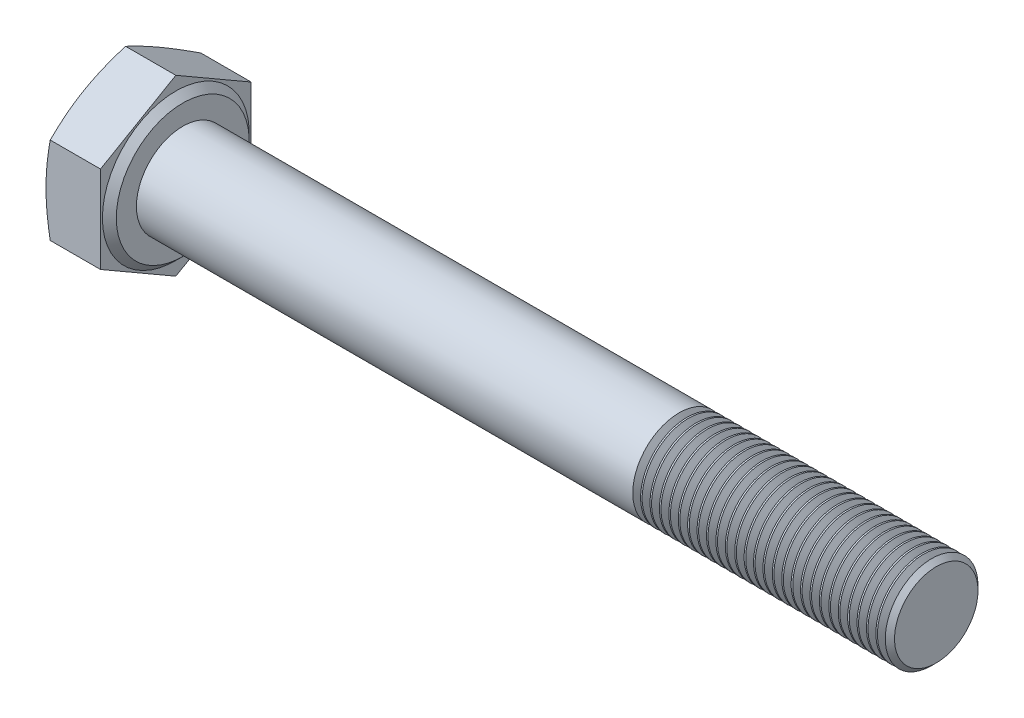
from build123d import *

# Parameters (mm, degrees)
BASEHEAD_DEPTH   = 5.3
SKETCH5_R        = 4
BASEBODY_DEPTH   = 65
CHAMFER1_SIZE    = 0.4
LPATTERN10_COUNT = 27
LPATTERN10_PITCH = 0.8118


with BuildPart() as part:
    # Sketch2 → BaseHead (new body)
    with BuildSketch(Plane(origin=(0, 0, 0), x_dir=(0, 0, -1), z_dir=(1, 0, 0))):
        Polygon((0, -7.505553499), (6.5, -3.75277675), (6.5, 3.75277675), (0, 7.505553499), (-6.5, 3.75277675), (-6.5, -3.75277675), align=None)
    extrude(amount=BASEHEAD_DEPTH)

    # Sketch3 → BearingFace (revolve, cut)
    with BuildSketch(Plane.XY, mode=Mode.PRIVATE) as bearingface_sk:
        Polygon((5.3, 7.505553499), (5.3, 5.735), (4.7, 6.335), (4.7, 7.505553499), align=None)
    revolve(bearingface_sk.sketch.rotate(Axis((-0.957090588, 0, 0), (1, 0, 0)), 90), axis=Axis((-0.957090588, 0, 0), (1, 0, 0)), mode=Mode.SUBTRACT)

    # Sketch4 → HeadChamfer (revolve, cut)
    with BuildSketch(Plane.XY):
        Polygon((0, 7.505553499), (0.365991543, 7.505553499), (0, 6.5), align=None)
    revolve(axis=Axis((-0.493528746, 0, 0), (1, 0, 0)), mode=Mode.SUBTRACT)

    # Sketch5 → BaseBody (add)
    with BuildSketch(Plane(origin=(5.3, 0, 0), x_dir=(0, 0, -1), z_dir=(1, 0, 0))):
        with Locations(Location((0, 0, 0), (0, 0, 180))):
            Circle(SKETCH5_R)
    extrude(amount=BASEBODY_DEPTH)

    # Chamfer1
    chamfer1_edges = [part.edges().sort_by_distance(p)[0] for p in [
        (70.3, 0, -4),
    ]]
    chamfer(chamfer1_edges, length=CHAMFER1_SIZE)

    # Sketch6 → Cut-Revolve10 (revolve, cut)
    with BuildSketch(Plane.XY, mode=Mode.PRIVATE) as cut_revolve10_sk:
        Polygon((69.2235, 4.6765), (69.9, 4.6765), (69.9, 4), (69.56175, 3.414133814), (69.2235, 4), align=None)
    cut_revolve10 = revolve(cut_revolve10_sk.sketch.rotate(Axis((70.3, 0, 0), (-1, 0, 0)), 90), axis=Axis((70.3, 0, 0), (-1, 0, 0)), mode=Mode.SUBTRACT)

    # LPattern10: Cut-Revolve10 ×27
    with Locations(*[(-i * LPATTERN10_PITCH, 0, 0) for i in range(1, LPATTERN10_COUNT)]):
        add(cut_revolve10, mode=Mode.SUBTRACT)


solid = part.part
